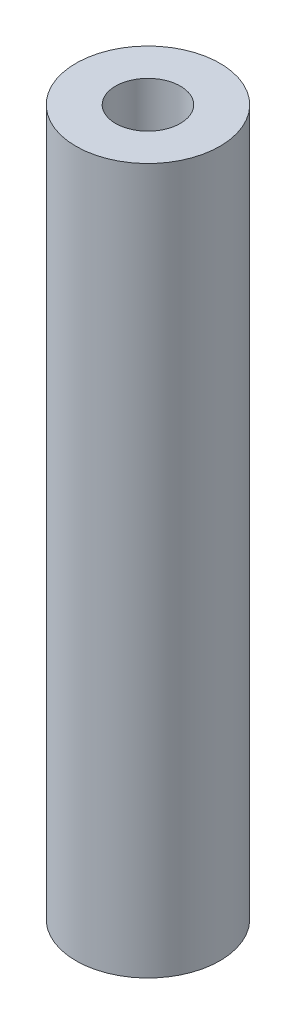
from build123d import *

# Parameters (mm, degrees)
CROQUIS1_R                   = 5
SALIENTE_EXTRUIR1_DEPTH      = 24.5
TALADRO_DE_MARGEN_PARA_M41_D = 4.5


with BuildPart() as part:
    # Croquis1 → Saliente-Extruir1 (new, symmetric)
    with BuildSketch(Plane(origin=(0, 0, 0), x_dir=(1, 0, 0), z_dir=(0, 1, 0))):
        with Locations(Location((0, 0, 0), (0, 0, 270))):
            Circle(CROQUIS1_R)
    extrude(amount=SALIENTE_EXTRUIR1_DEPTH, both=True)

    # Taladro de margen para M41 (through all)
    with Locations(Plane(origin=(0, 24.5, 0), x_dir=(1, 0, 0), z_dir=(0, 1, 0))):
        with Locations((0, 0)):
            Hole(TALADRO_DE_MARGEN_PARA_M41_D / 2)


solid = part.part
